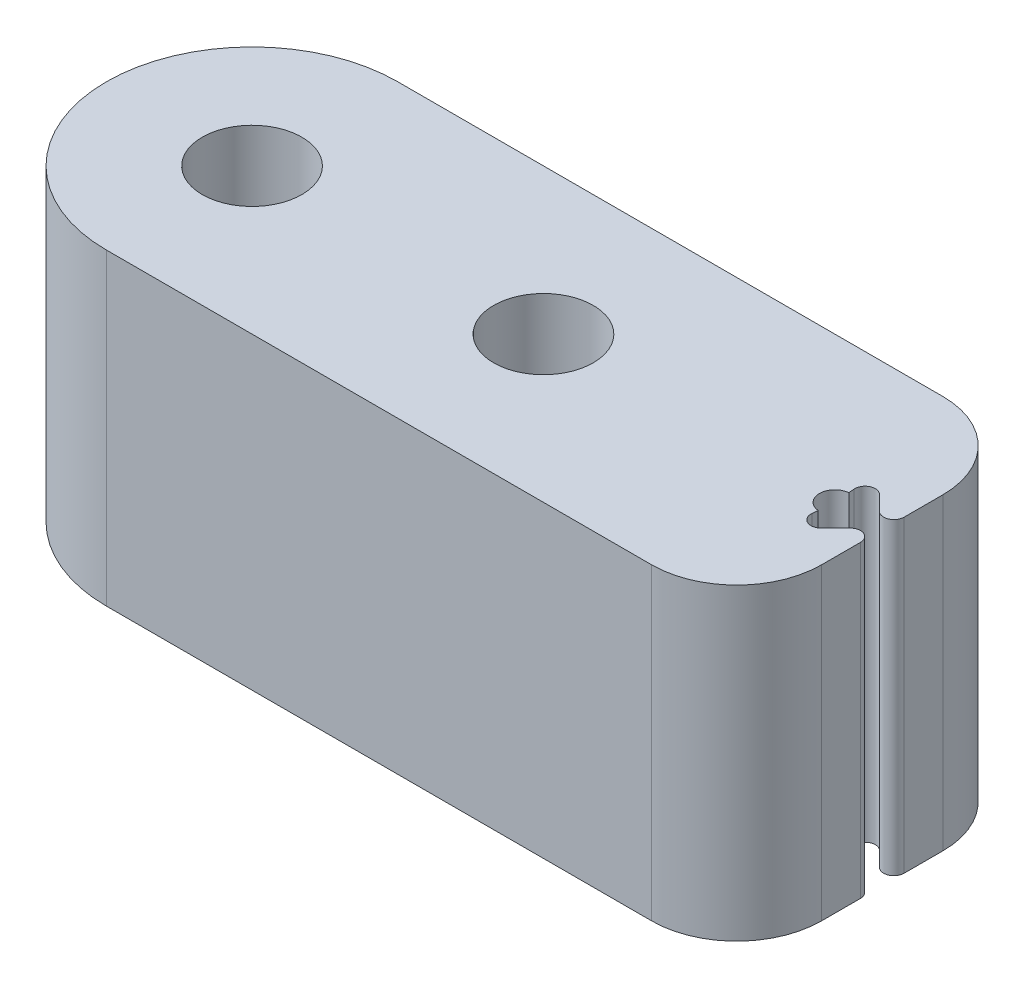
from build123d import *

# Parameters (mm, degrees)
SKETCH1_R           = 2.05
BOSS_EXTRUDE1_DEPTH = 12.7


with BuildPart() as part:
    # Sketch1 → Boss-Extrude1 (new body)
    with BuildSketch(Plane(origin=(0, 0, 0), x_dir=(1, 0, 0), z_dir=(0, 1, 0))):
        with BuildLine():
            Line((-4.055343897, 0.632583633), (-4.075844459, 0.866906139))
            ThreePointArc((-4.075844459, 0.866906139), (-3.83530083, 1.283539926), (-3.361522369, 1.2))
            Line((-3.361522369, 1.2), (-2.761522369, 0.6))
            ThreePointArc((-2.761522369, 0.6), (-2.304491577, 0.509090923), (-2.04560443, 0.89654292))
            Line((-2.04560443, 0.89654292), (-2.04560443, 2.5))
            ThreePointArc((-2.04560443, 2.5), (-3.070730696, 4.974873734), (-5.54560443, 6))
            Line((-5.54560443, 6), (-28, 6))
            ThreePointArc((-28, 6), (-34, 0), (-28, -6))
            Line((-28, -6), (-5.54560443, -6))
            ThreePointArc((-5.54560443, -6), (-3.070730696, -4.974873734), (-2.04560443, -2.5))
            Line((-2.04560443, -2.5), (-2.04560443, -0.89654292))
            ThreePointArc((-2.04560443, -0.89654292), (-2.304491577, -0.509090923), (-2.761522369, -0.6))
            Line((-2.761522369, -0.6), (-3.361522369, -1.2))
            ThreePointArc((-3.361522369, -1.2), (-3.83530083, -1.283539926), (-4.075844459, -0.866906139))
            Line((-4.075844459, -0.866906139), (-4.055343897, -0.632583633))
            ThreePointArc((-4.055343897, -0.632583633), (-4.635, 0), (-4.055343897, 0.632583633))
        make_face()
        with Locations(Location((-16, 0, 0), (0, 0, 270))):
            Circle(SKETCH1_R, mode=Mode.SUBTRACT)
        with Locations(Location((-28, 0, 0), (0, 0, 270))):
            Circle(SKETCH1_R, mode=Mode.SUBTRACT)
    extrude(amount=BOSS_EXTRUDE1_DEPTH)


solid = part.part
